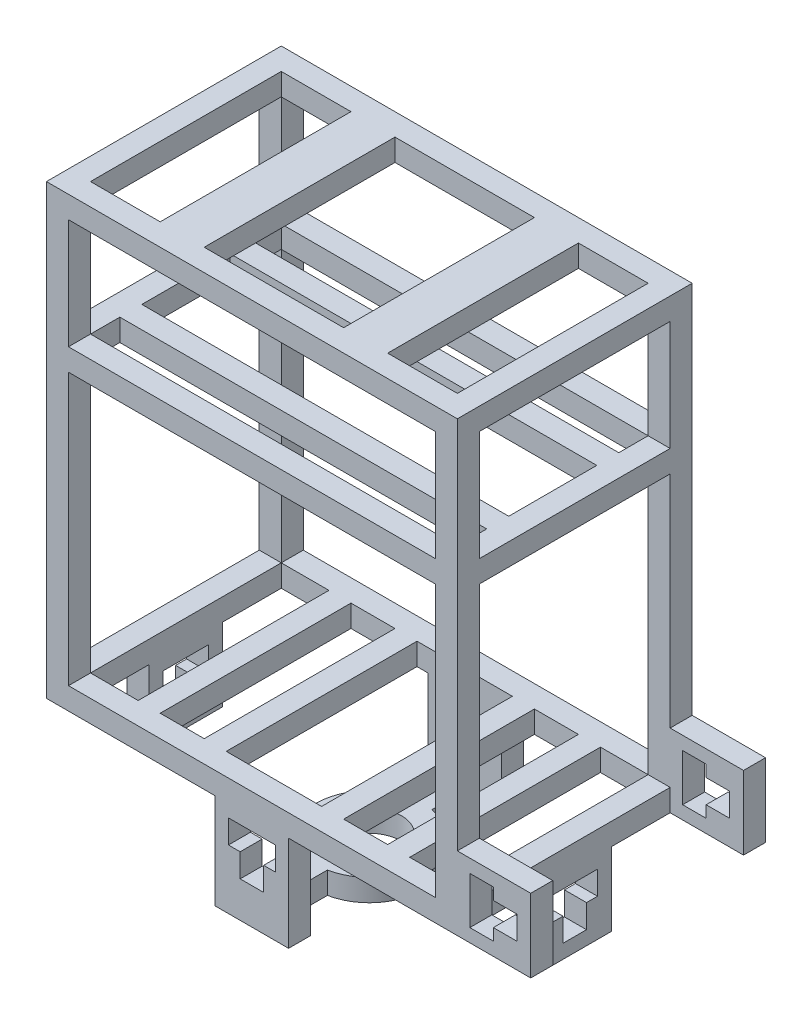
from build123d import *

# Parameters (mm, degrees)
SKETCH1_W            = 56
SKETCH1_H            = 32
SKETCH1_W_2          = 50
SKETCH1_H_2          = 26
BOSS_EXTRUDE1_DEPTH  = 3
SKETCH2_W            = 3
SKETCH2_H            = 3
BOSS_EXTRUDE2_DEPTH  = 40
BOSS_EXTRUDE3_DEPTH  = 3
BOSS_EXTRUDE4_DEPTH  = 3
SKETCH5_W            = 3
SKETCH5_H            = 26
BOSS_EXTRUDE5_DEPTH  = 3
SKETCH6_W            = 50
SKETCH6_H            = 3
SKETCH6_W_2          = 3
BOSS_EXTRUDE7_DEPTH  = 3
SKETCH7_W            = 3
SKETCH7_H            = 3
BOSS_EXTRUDE8_DEPTH  = 15
SKETCH8_W            = 3
SKETCH8_H            = 26
SKETCH8_W_2          = 6
SKETCH8_H_2          = 3
BOSS_EXTRUDE9_DEPTH  = 3
BOSS_EXTRUDE10_DEPTH = 3
BOSS_EXTRUDE11_DEPTH = 3


with BuildPart() as part:
    # Sketch1 → Boss-Extrude1 (new body)
    with BuildSketch(Plane(origin=(0, 0, 0), x_dir=(1, 0, 0), z_dir=(0, 1, 0))):
        Rectangle(SKETCH1_W, SKETCH1_H)
        Rectangle(SKETCH1_W_2, SKETCH1_H_2, mode=Mode.SUBTRACT)
    extrude(amount=BOSS_EXTRUDE1_DEPTH)

    # Sketch2 → Boss-Extrude2 (add)
    with BuildSketch(Plane(origin=(0, 0, 0), x_dir=(1, 0, 0), z_dir=(0, 1, 0))):
        with Locations((26.5, 14.5)):
            Rectangle(SKETCH2_W, SKETCH2_H)
        with Locations((26.5, -14.5)):
            Rectangle(SKETCH2_W, SKETCH2_H)
        with Locations((-26.5, -14.5)):
            Rectangle(SKETCH2_W, SKETCH2_H)
        with Locations((-26.5, 14.5)):
            Rectangle(SKETCH2_W, SKETCH2_H)
    extrude(amount=BOSS_EXTRUDE2_DEPTH)

    # Sketch3 → Boss-Extrude3 (add)
    with BuildSketch(Plane.XY.offset(16)):
        Polygon((28, 10), (28, 5), (29.7, 5), (29.7, 8.2), (32.9, 8.2), (32.9, 6.6), (36.1, 6.6), (36.1, 5), (38, 5), (38, 10), align=None)
        Polygon((28, 5), (28, 0), (38, 0), (38, 5), (36.1, 5), (36.1, 3.4), (32.9, 3.4), (32.9, 1.8), (29.7, 1.8), (29.7, 5), align=None)
    boss_extrude3 = extrude(amount=-BOSS_EXTRUDE3_DEPTH)

    # Mirror1: Boss-Extrude3 across plane
    add(boss_extrude3.mirror(Plane.XY))

    # Sketch4 → Boss-Extrude4 (add)
    with BuildSketch(Plane.XY.offset(16)):
        Polygon((5, 0), (0, 0), (-5, 0), (-5, -10), (0, -10), (5, -10), align=None)
        Polygon((1.6, -8.1), (0, -8.1), (-1.6, -8.1), (-1.6, -4.9), (-3.2, -4.9), (-3.2, -1.7), (3.2, -1.7), (3.2, -4.9), (1.6, -4.9), align=None, mode=Mode.SUBTRACT)
    boss_extrude4 = extrude(amount=-BOSS_EXTRUDE4_DEPTH)

    # Mirror2: Boss-Extrude4 across plane
    add(boss_extrude4.mirror(Plane.XY))

    # Sketch5 → Boss-Extrude5 (add)
    with BuildSketch(Plane(origin=(0, 3, 0), x_dir=(1, 0, 0), z_dir=(0, 1, 0))):
        with Locations((-17, 0)):
            Rectangle(SKETCH5_W, SKETCH5_H)
        with Locations((-8, 0)):
            Rectangle(SKETCH5_W, SKETCH5_H)
        with Locations((8, 0)):
            Rectangle(SKETCH5_W, SKETCH5_H)
        with Locations((17, 0)):
            Rectangle(SKETCH5_W, SKETCH5_H)
    extrude(amount=-BOSS_EXTRUDE5_DEPTH)

    # Sketch6 → Boss-Extrude7 (add)
    # profile 1 of 4: a face of its own
    with BuildSketch(Plane(origin=(0, 40, 0), x_dir=(1, 0, 0), z_dir=(0, 1, 0))):
        Polygon((-28, -16), (25, -16), (25, -13), (28, -13), (28, 16), (-28, 16), align=None)
        Polygon((25, -9), (25, -13), (-25, -13), (-25, -9), (-25, -6), (-25, 6), (-25, 9), (-25, 13), (25, 13), (25, 9), (25, 6), (25, -6), align=None, mode=Mode.SUBTRACT)
    # profile 2 of 4: a face of its own
    with BuildSketch(Plane(origin=(0, 40, 0), x_dir=(1, 0, 0), z_dir=(0, 1, 0))):
        with Locations((0, -7.5)):
            Rectangle(SKETCH6_W, SKETCH6_H)
    # profile 3 of 4: a face of its own
    with BuildSketch(Plane(origin=(0, 40, 0), x_dir=(1, 0, 0), z_dir=(0, 1, 0))):
        with Locations((0, 7.5)):
            Rectangle(SKETCH6_W, SKETCH6_H)
    # profile 4 of 4: a face of its own
    with BuildSketch(Plane(origin=(0, 40, 0), x_dir=(1, 0, 0), z_dir=(0, 1, 0))):
        with Locations((26.5, -14.5)):
            Rectangle(SKETCH6_W_2, SKETCH6_H)
    extrude(amount=BOSS_EXTRUDE7_DEPTH)

    # Sketch7 → Boss-Extrude8 (add)
    with BuildSketch(Plane(origin=(0, 43, 0), x_dir=(1, 0, 0), z_dir=(0, 1, 0))):
        with Locations((-26.5, -14.5)):
            Rectangle(SKETCH7_W, SKETCH7_H)
        with Locations((-26.5, 14.5)):
            Rectangle(SKETCH7_W, SKETCH7_H)
        with Locations((26.5, 14.5)):
            Rectangle(SKETCH7_W, SKETCH7_H)
        with Locations((26.5, -14.5)):
            Rectangle(SKETCH7_W, SKETCH7_H)
    extrude(amount=BOSS_EXTRUDE8_DEPTH)

    # Sketch8 → Boss-Extrude9 (add)
    # profile 1 of 5: a face of its own
    with BuildSketch(Plane(origin=(0, 58, 0), x_dir=(1, 0, 0), z_dir=(0, 1, 0))):
        Polygon((-25, 16), (-25, 13), (-28, 13), (-28, -16), (28, -16), (28, 16), align=None)
        Polygon((25, 13), (25, -13), (15.5, -13), (12.5, -13), (9.5, -13), (0, -13), (-9.5, -13), (-15.5, -13), (-25, -13), (-25, 13), (-15.5, 13), (-9.5, 13), (9.5, 13), (12.5, 13), (15.5, 13), align=None, mode=Mode.SUBTRACT)
    # profile 2 of 5: a face of its own
    with BuildSketch(Plane(origin=(0, 58, 0), x_dir=(1, 0, 0), z_dir=(0, 1, 0))):
        with Locations((11, 0)):
            Rectangle(SKETCH8_W, SKETCH8_H)
    # profile 3 of 5: a face of its own
    with BuildSketch(Plane(origin=(0, 58, 0), x_dir=(1, 0, 0), z_dir=(0, 1, 0))):
        with Locations((14, 0)):
            Rectangle(SKETCH8_W, SKETCH8_H)
    # profile 4 of 5: a face of its own
    with BuildSketch(Plane(origin=(0, 58, 0), x_dir=(1, 0, 0), z_dir=(0, 1, 0))):
        with Locations((-12.5, 0)):
            Rectangle(SKETCH8_W_2, SKETCH8_H)
    # profile 5 of 5: a face of its own
    with BuildSketch(Plane(origin=(0, 58, 0), x_dir=(1, 0, 0), z_dir=(0, 1, 0))):
        with Locations((-26.5, 14.5)):
            Rectangle(SKETCH8_W, SKETCH8_H_2)
    extrude(amount=BOSS_EXTRUDE9_DEPTH)

    # Sketch9 → Boss-Extrude10 (add)
    with BuildSketch(Plane.XZ.offset(10)):
        with BuildLine():
            ThreePointArc((-5, -5.25), (-3.378132989, -6.414882502), (-1.5, -7.09313048))
            Line((-1.5, -7.09313048), (-1.5, -4.083197277))
            ThreePointArc((-1.5, -4.083197277), (-4.35, 0), (-1.5, 4.083197277))
            Line((-1.5, 4.083197277), (-1.5, 7.09313048))
            ThreePointArc((-1.5, 7.09313048), (-3.378132989, 6.414882502), (-5, 5.25))
            Line((-5, 5.25), (-5, -5.25))
        make_face()
        with BuildLine():
            ThreePointArc((-5, 5.25), (-7.25, 0), (-5, -5.25))
            Line((-5, -5.25), (-5, 5.25))
        make_face()
        with BuildLine():
            Line((-1.5, -4.083197277), (-1.5, -7.09313048))
            ThreePointArc((-1.5, -7.09313048), (-0.051031089, -7.2498204), (1.4, -7.113543421))
            Line((1.4, -7.113543421), (1.4, -4.118555572))
            ThreePointArc((1.4, -4.118555572), (-0.053033501, -4.349676706), (-1.5, -4.083197277))
        make_face()
        with BuildLine():
            Line((-1.5, 7.09313048), (-1.5, 4.083197277))
            ThreePointArc((-1.5, 4.083197277), (-0.053033501, 4.349676706), (1.4, 4.118555572))
            Line((1.4, 4.118555572), (1.4, 7.113543421))
            ThreePointArc((1.4, 7.113543421), (-0.051031089, 7.2498204), (-1.5, 7.09313048))
        make_face()
        with BuildLine():
            Line((1.4, -4.118555572), (1.4, -7.113543421))
            ThreePointArc((1.4, -7.113543421), (3.332896416, -6.438501493), (5, -5.25))
            Line((5, -5.25), (5, 5.25))
            ThreePointArc((5, 5.25), (3.332896416, 6.438501493), (1.4, 7.113543421))
            Line((1.4, 7.113543421), (1.4, 4.118555572))
            ThreePointArc((1.4, 4.118555572), (3.536417679, 2.53303178), (4.35, 0))
            ThreePointArc((4.35, 0), (3.536417679, -2.53303178), (1.4, -4.118555572))
        make_face()
        with BuildLine():
            Line((5, 5.25), (5, -5.25))
            ThreePointArc((5, -5.25), (6.663801468, -2.855914915), (7.25, 0))
            ThreePointArc((7.25, 0), (6.663801468, 2.855914915), (5, 5.25))
        make_face()
        with BuildLine():
            Line((-1.5, 13), (-1.5, 7.09313048))
            ThreePointArc((-1.5, 7.09313048), (-0.051031089, 7.2498204), (1.4, 7.113543421))
            Line((1.4, 7.113543421), (1.4, 13))
            Line((1.4, 13), (-1.5, 13))
        make_face()
        Polygon((-5, 16), (-5, 13), (-1.5, 13), (1.4, 13), (5, 13), (5, 16), align=None)
        with BuildLine():
            Line((-1.5, -13), (0, -13))
            Line((0, -13), (1.4, -13))
            Line((1.4, -13), (1.4, -7.113543421))
            ThreePointArc((1.4, -7.113543421), (-0.051031089, -7.2498204), (-1.5, -7.09313048))
            Line((-1.5, -7.09313048), (-1.5, -13))
        make_face()
        Polygon((1.4, -13), (0, -13), (-1.5, -13), (-5, -13), (-5, -16), (5, -16), (5, -13), align=None)
    extrude(amount=BOSS_EXTRUDE10_DEPTH)

    # Sketch10 → Boss-Extrude11 (add)
    with BuildSketch(Plane(origin=(28, 0, 0), x_dir=(0, 0, -1), z_dir=(1, 0, 0))):
        Polygon((5, 0), (0, 0), (-5, 0), (-5, -10), (0, -10), (5, -10), align=None)
        Polygon((1.6, -8.1), (0, -8.1), (-1.6, -8.1), (-1.6, -4.9), (-3.1, -4.9), (-3.1, -1.7), (3.1, -1.7), (3.1, -4.9), (1.6, -4.9), align=None, mode=Mode.SUBTRACT)
    boss_extrude11 = extrude(amount=-BOSS_EXTRUDE11_DEPTH)

    # Mirror3: Boss-Extrude11 across plane
    add(boss_extrude11.mirror(Plane(origin=(0, 0, 0), x_dir=(0, 0, 1), z_dir=(1, 0, 0))))


solid = part.part
